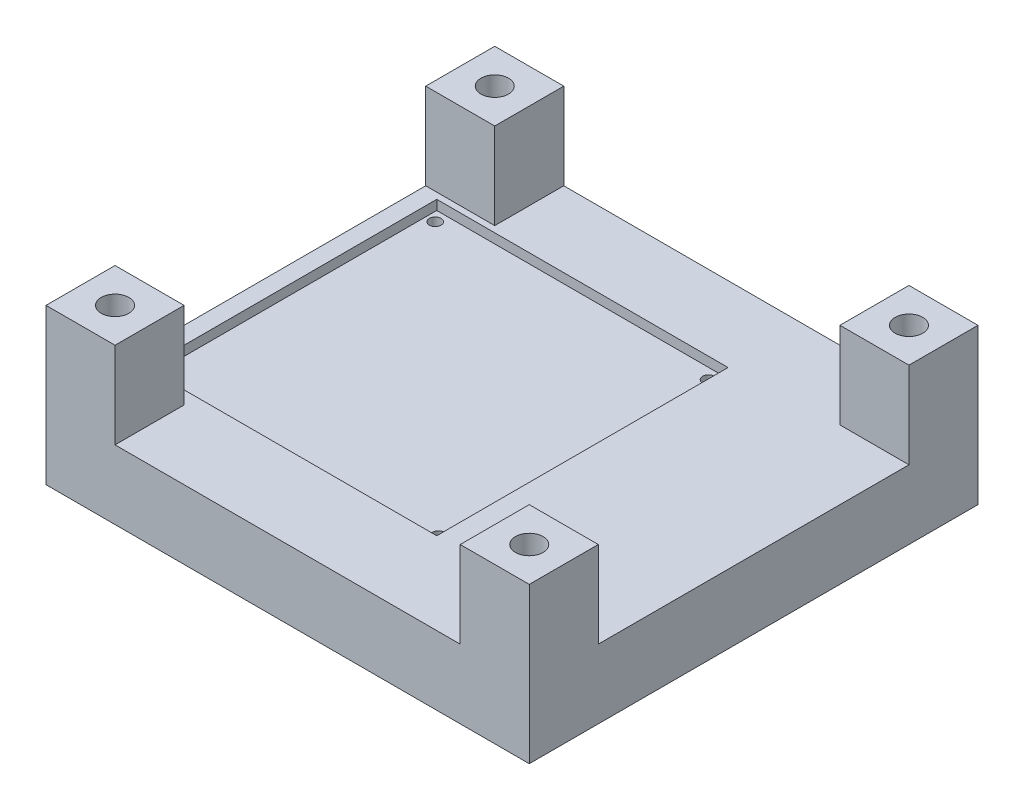
from build123d import *

# Parameters (mm, degrees)
SKETCH2_W                = 177.8
SKETCH2_H                = 165.1
BOSS_EXTRUDE1_DEPTH      = 25.4
SKETCH6_W                = 25.4
SKETCH6_H                = 25.4
BOSS_EXTRUDE2_DEPTH      = 31.75
MIRROR2_COPY_1_SKETCH_W  = 25.4
MIRROR2_COPY_1_SKETCH_H  = 25.4
MIRROR2_COPY_1_DEPTH     = 31.75
MIRROR2_COPY_2_SKETCH_W  = 25.4
MIRROR2_COPY_2_SKETCH_H  = 25.4
MIRROR2_COPY_2_DEPTH     = 31.75
SKETCH9_W                = 107.188
SKETCH9_H                = 107.188
CUT_EXTRUDE3_DEPTH       = 3.556
SKETCH10_RX              = 2.159
SKETCH10_RY              = 2.159
CUT_EXTRUDE4_DEPTH       = 20.32
MIRROR4_COPY_1_SKETCH_RX = 2.159
MIRROR4_COPY_1_SKETCH_RY = 2.159
MIRROR4_COPY_1_DEPTH     = 20.32
MIRROR4_COPY_2_SKETCH_RX = 2.159
MIRROR4_COPY_2_SKETCH_RY = 2.159
MIRROR4_COPY_2_DEPTH     = 20.32
SKETCH14_R               = 5.08
CUT_EXTRUDE5_DEPTH       = 20.32
MIRROR6_COPY_1_SKETCH_R  = 5.08
MIRROR6_COPY_1_DEPTH     = 20.32
MIRROR6_COPY_2_SKETCH_R  = 5.08
MIRROR6_COPY_2_DEPTH     = 20.32


with BuildPart() as part:
    # Sketch2 → Boss-Extrude1 (new body)
    with BuildSketch(Plane(origin=(0, 0, 0), x_dir=(1, 0, 0), z_dir=(0, 1, 0))):
        with Locations((88.9, -82.55)):
            Rectangle(SKETCH2_W, SKETCH2_H)
    extrude(amount=BOSS_EXTRUDE1_DEPTH)

    # Sketch6 → Boss-Extrude2 (add)
    with BuildSketch(Plane(origin=(0, 25.4, 0), x_dir=(1, 0, 0), z_dir=(0, 1, 0))):
        with Locations((12.7, -12.7)):
            Rectangle(SKETCH6_W, SKETCH6_H)
    boss_extrude2 = extrude(amount=BOSS_EXTRUDE2_DEPTH)

    # Mirror1: Boss-Extrude2 across plane
    add(boss_extrude2.mirror(Plane(origin=(0, 0, 82.55), x_dir=(1, 0, 0), z_dir=(0, 0, -1))))

    # Mirror2 copy 1 sketch → Mirror2 copy 1 (add)
    with BuildSketch(Plane(origin=(177.8, 25.4, 165.1), x_dir=(-1, 0, 0), z_dir=(0, 1, 0))):
        with Locations((12.7, -12.7)):
            Rectangle(MIRROR2_COPY_1_SKETCH_W, MIRROR2_COPY_1_SKETCH_H)
    extrude(amount=MIRROR2_COPY_1_DEPTH)

    # Mirror2 copy 2 sketch → Mirror2 copy 2 (add)
    with BuildSketch(Plane(origin=(177.8, 25.4, 0), x_dir=(-1, 0, 0), z_dir=(0, 1, 0))):
        with Locations((12.7, 12.7)):
            Rectangle(MIRROR2_COPY_2_SKETCH_W, MIRROR2_COPY_2_SKETCH_H)
    extrude(amount=MIRROR2_COPY_2_DEPTH)

    # Sketch9 → Cut-Extrude3 (cut)
    with BuildSketch(Plane(origin=(0, 25.4, 0), x_dir=(1, 0, 0), z_dir=(0, 1, 0))):
        with Locations((59.944, -81.276983136)):
            Rectangle(SKETCH9_W, SKETCH9_H)
    extrude(amount=-CUT_EXTRUDE3_DEPTH, mode=Mode.SUBTRACT)

    # Sketch10 → Cut-Extrude4 (cut)
    with BuildSketch(Plane(origin=(0, 21.844, 0), x_dir=(1, 0, 0), z_dir=(0, 1, 0))):
        with Locations(Location((9.662951288, -31.573935809), (0, 0, 56.28607255))):
            Ellipse(SKETCH10_RX, SKETCH10_RY)
    cut_extrude4 = extrude(amount=-CUT_EXTRUDE4_DEPTH, mode=Mode.SUBTRACT)

    # Mirror3: Cut-Extrude4 across plane
    add(cut_extrude4.mirror(Plane.XY.offset(81.276983136)), mode=Mode.SUBTRACT)

    # Mirror4 copy 1 sketch → Mirror4 copy 1 (cut)
    with BuildSketch(Plane(origin=(119.888, 21.844, 162.553966273), x_dir=(-1, 0, 0), z_dir=(0, 1, 0))):
        with Locations(Location((9.662951288, -31.573935809), (0, 0, 56.28607255))):
            Ellipse(MIRROR4_COPY_1_SKETCH_RX, MIRROR4_COPY_1_SKETCH_RY)
    extrude(amount=-MIRROR4_COPY_1_DEPTH, mode=Mode.SUBTRACT)

    # Mirror4 copy 2 sketch → Mirror4 copy 2 (cut)
    with BuildSketch(Plane(origin=(119.888, 21.844, 0), x_dir=(-1, 0, 0), z_dir=(0, 1, 0))):
        with Locations(Location((9.662951288, 31.573935809), (0, 0, -56.28607255))):
            Ellipse(MIRROR4_COPY_2_SKETCH_RX, MIRROR4_COPY_2_SKETCH_RY)
    extrude(amount=-MIRROR4_COPY_2_DEPTH, mode=Mode.SUBTRACT)

    # Sketch14 → Cut-Extrude5 (cut)
    with BuildSketch(Plane(origin=(0, 57.15, 0), x_dir=(1, 0, 0), z_dir=(0, 1, 0))):
        with Locations((12.7, -12.7)):
            Circle(SKETCH14_R)
    cut_extrude5 = extrude(amount=-CUT_EXTRUDE5_DEPTH, mode=Mode.SUBTRACT)

    # Mirror5: Cut-Extrude5 across plane
    add(cut_extrude5.mirror(Plane.ZY.offset(-88.9)), mode=Mode.SUBTRACT)

    # Mirror6 copy 1 sketch → Mirror6 copy 1 (cut)
    with BuildSketch(Plane(origin=(177.8, 57.15, 165.1), x_dir=(-1, 0, 0), z_dir=(0, 1, 0))):
        with Locations((12.7, -12.7)):
            Circle(MIRROR6_COPY_1_SKETCH_R)
    extrude(amount=-MIRROR6_COPY_1_DEPTH, mode=Mode.SUBTRACT)

    # Mirror6 copy 2 sketch → Mirror6 copy 2 (cut)
    with BuildSketch(Plane(origin=(0, 57.15, 165.1), x_dir=(1, 0, 0), z_dir=(0, 1, 0))):
        with Locations((12.7, 12.7)):
            Circle(MIRROR6_COPY_2_SKETCH_R)
    extrude(amount=-MIRROR6_COPY_2_DEPTH, mode=Mode.SUBTRACT)


solid = part.part
